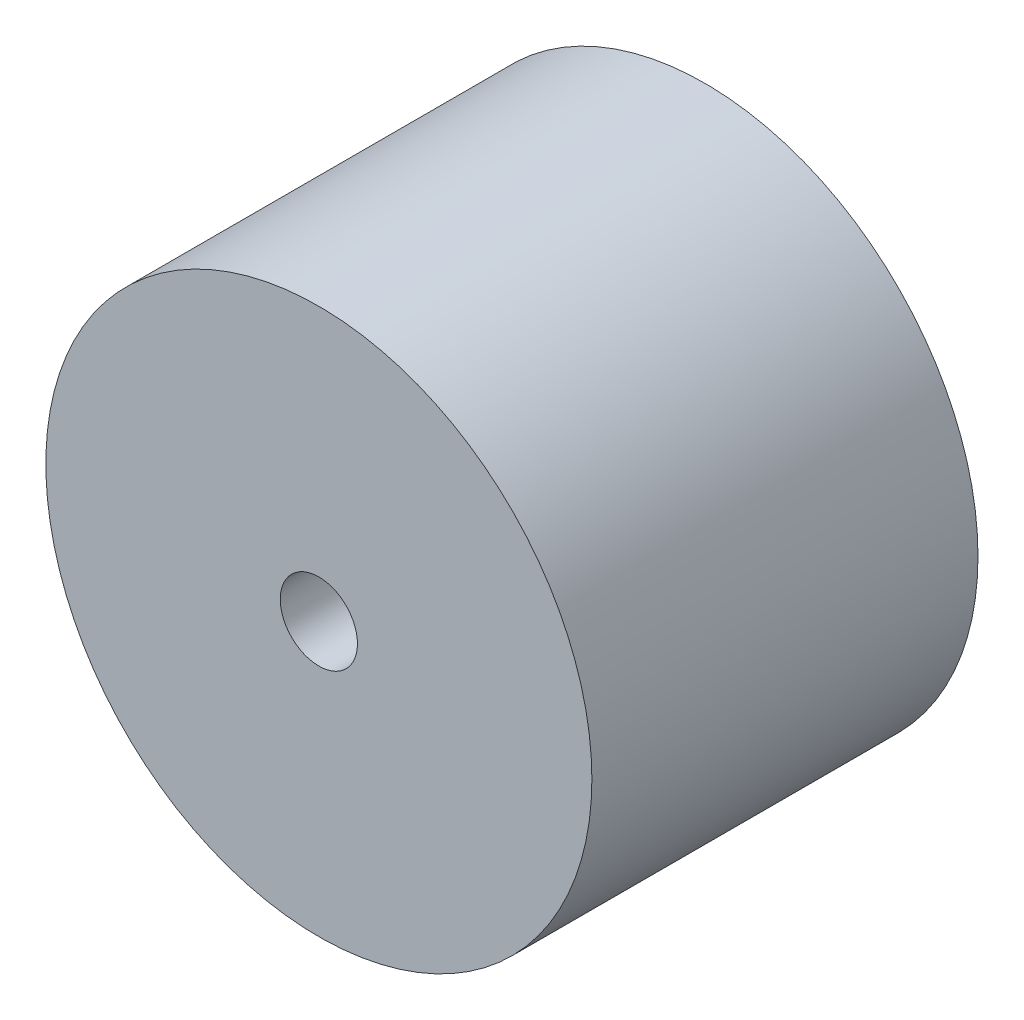
from build123d import *

# Parameters (mm, degrees)
SKETCH_2_R      = 10.606601718
SKETCH_2_R_2    = 1.5
EXTRUDE_1_DEPTH = 15


with BuildPart() as part:
    # ｽｹｯﾁ2 → ﾎﾞｽ - 押し出し1 (new body)
    with BuildSketch(Plane.XY):
        Circle(SKETCH_2_R)
        Circle(SKETCH_2_R_2, mode=Mode.SUBTRACT)
    extrude(amount=EXTRUDE_1_DEPTH)


solid = part.part
